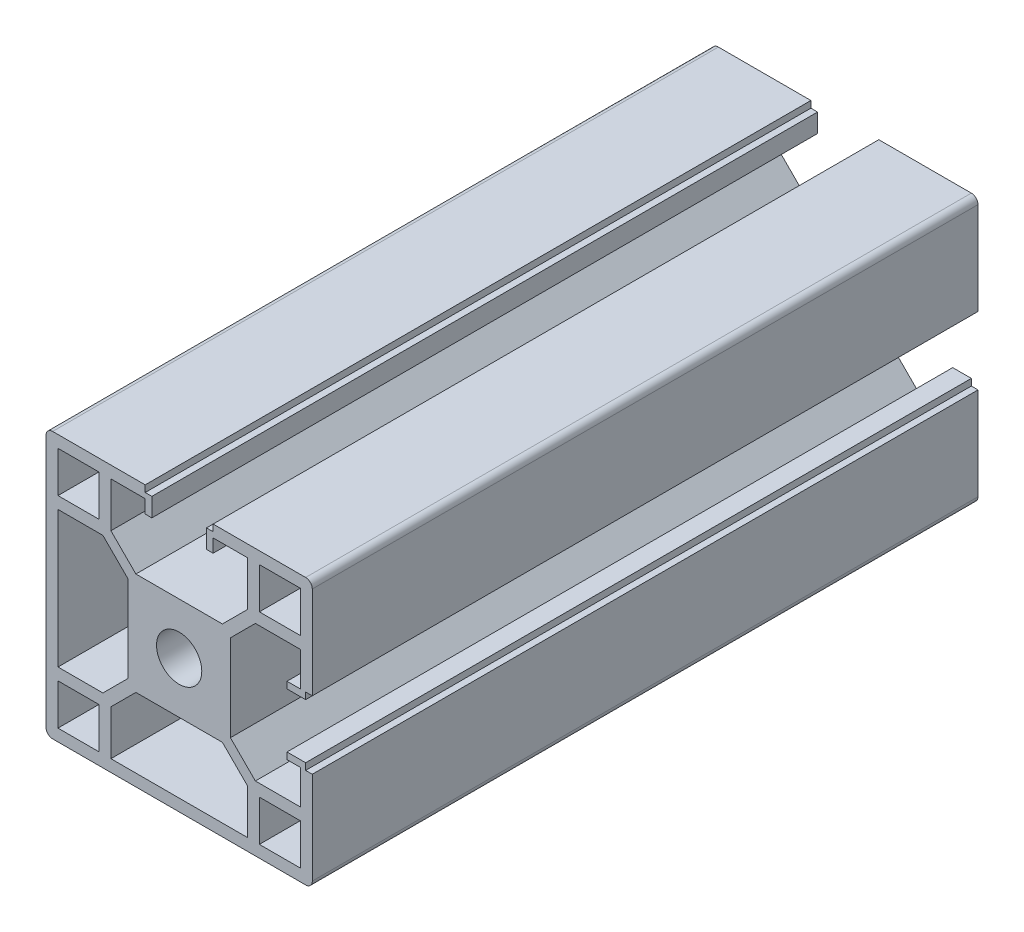
from build123d import *

# Parameters (mm, degrees)
SKETCH_1_R      = 3.4
SKETCH_1_W      = 6.15
SKETCH_1_H      = 6.15
EXTRUDE_1_DEPTH = 100


with BuildPart() as part:
    # 草图1 → 凸台-拉伸1 (new body)
    with BuildSketch(Plane.XY):
        with BuildLine():
            Line((-4.068782805, 19.545792426), (-17.968782805, 19.545792426))
            ThreePointArc((-17.968782805, 19.545792426), (-18.675889586, 19.252899208), (-18.968782805, 18.545792426))
            Line((-18.968782805, 18.545792426), (-18.968782805, 4.645792426))
            Line((-18.968782805, 4.645792426), (-18.968782805, -5.554207574))
            Line((-18.968782805, -5.554207574), (-18.968782805, -19.454207574))
            ThreePointArc((-18.968782805, -19.454207574), (-18.675889586, -20.161314355), (-17.968782805, -20.454207574))
            Line((-17.968782805, -20.454207574), (20.031217195, -20.454207574))
            ThreePointArc((20.031217195, -20.454207574), (20.738323976, -20.161314355), (21.031217195, -19.454207574))
            Line((21.031217195, -19.454207574), (21.031217195, -5.554207574))
            Line((21.031217195, -5.554207574), (20.031217195, -5.554207574))
            Line((20.031217195, -5.554207574), (20.031217195, -4.554207574))
            Line((20.031217195, -4.554207574), (17.231217195, -4.554207574))
            Line((17.231217195, -4.554207574), (17.231217195, -5.554207574))
            Line((17.231217195, -5.554207574), (19.231217195, -5.554207574))
            Line((19.231217195, -5.554207574), (19.231217195, -10.704207574))
            Line((19.231217195, -10.704207574), (12.483298723, -10.704207574))
            Line((12.483298723, -10.704207574), (8.731217195, -6.952126046))
            Line((8.731217195, -6.952126046), (8.731217195, 6.043710898))
            Line((8.731217195, 6.043710898), (12.483298723, 9.795792426))
            Line((12.483298723, 9.795792426), (19.231217195, 9.795792426))
            Line((19.231217195, 9.795792426), (19.231217195, 4.645792426))
            Line((19.231217195, 4.645792426), (17.231217195, 4.645792426))
            Line((17.231217195, 4.645792426), (17.231217195, 3.645792426))
            Line((17.231217195, 3.645792426), (20.031217195, 3.645792426))
            Line((20.031217195, 3.645792426), (20.031217195, 4.645792426))
            Line((20.031217195, 4.645792426), (21.031217195, 4.645792426))
            Line((21.031217195, 4.645792426), (21.031217195, 18.545792426))
            ThreePointArc((21.031217195, 18.545792426), (20.738323976, 19.252899208), (20.031217195, 19.545792426))
            Line((20.031217195, 19.545792426), (6.131217195, 19.545792426))
            Line((6.131217195, 19.545792426), (6.131217195, 18.545792426))
            Line((6.131217195, 18.545792426), (5.131217195, 18.545792426))
            Line((5.131217195, 18.545792426), (5.131217195, 15.745792426))
            Line((5.131217195, 15.745792426), (6.131217195, 15.745792426))
            Line((6.131217195, 15.745792426), (6.131217195, 17.745792426))
            Line((6.131217195, 17.745792426), (11.281217195, 17.745792426))
            Line((11.281217195, 17.745792426), (11.281217195, 10.997873954))
            Line((11.281217195, 10.997873954), (7.529135667, 7.245792426))
            Line((7.529135667, 7.245792426), (-5.466701277, 7.245792426))
            Line((-5.466701277, 7.245792426), (-9.218782805, 10.997873954))
            Line((-9.218782805, 10.997873954), (-9.218782805, 17.745792426))
            Line((-9.218782805, 17.745792426), (-4.068782805, 17.745792426))
            Line((-4.068782805, 17.745792426), (-4.068782805, 15.745792426))
            Line((-4.068782805, 15.745792426), (-3.068782805, 15.745792426))
            Line((-3.068782805, 15.745792426), (-3.068782805, 18.545792426))
            Line((-3.068782805, 18.545792426), (-4.068782805, 18.545792426))
            Line((-4.068782805, 18.545792426), (-4.068782805, 19.545792426))
        make_face()
        with Locations((1.031217195, -0.454207574)):
            Circle(SKETCH_1_R, mode=Mode.SUBTRACT)
        with Locations((-14.093782805, 14.670792426)):
            Rectangle(SKETCH_1_W, SKETCH_1_H, mode=Mode.SUBTRACT)
        Polygon((-6.668782805, 6.043710898), (-6.668782805, -6.952126046), (-10.420864333, -10.704207574), (-17.168782805, -10.704207574), (-17.168782805, 9.795792426), (-10.420864333, 9.795792426), align=None, mode=Mode.SUBTRACT)
        Polygon((-5.466701277, -8.154207574), (7.529135667, -8.154207574), (11.281217195, -11.906289102), (11.281217195, -18.654207574), (-9.218782805, -18.654207574), (-9.218782805, -11.906289102), align=None, mode=Mode.SUBTRACT)
        with Locations((16.156217195, 14.670792426)):
            Rectangle(SKETCH_1_W, SKETCH_1_H, mode=Mode.SUBTRACT)
        with Locations((-14.093782805, -15.579207574)):
            Rectangle(SKETCH_1_W, SKETCH_1_H, mode=Mode.SUBTRACT)
        with Locations((16.156217195, -15.579207574)):
            Rectangle(SKETCH_1_W, SKETCH_1_H, mode=Mode.SUBTRACT)
    extrude(amount=EXTRUDE_1_DEPTH)


solid = part.part
